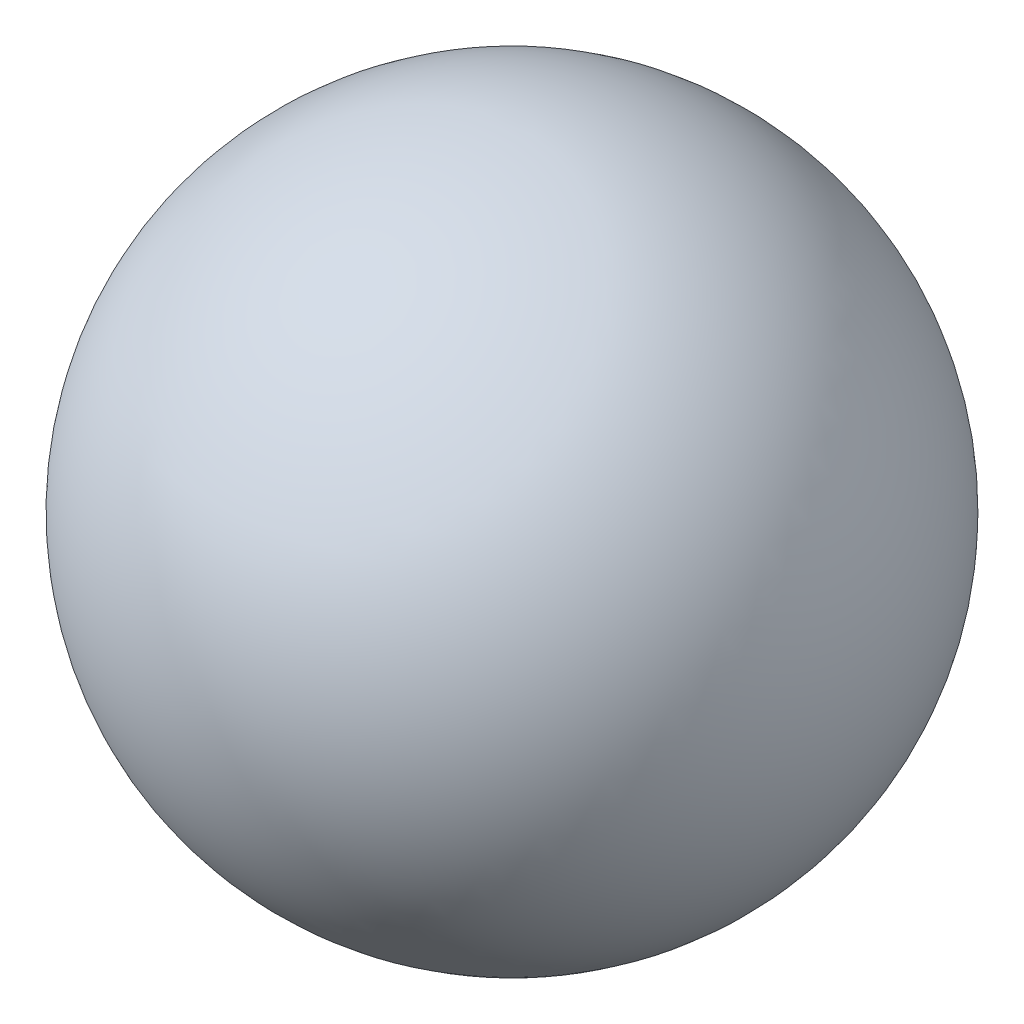
from build123d import *


with BuildPart() as part:
    # Esboço1 → Revolução1 (revolve)
    with BuildSketch(Plane.XY):
        with BuildLine():
            Line((2.280788411, -74.965312006), (-2.280788411, 74.965312006))
            ThreePointArc((-2.280788411, 74.965312006), (-74.965312006, -2.280788411), (2.280788411, -74.965312006))
        make_face()
    revolve(axis=Axis((2.280788411, -74.965312006, 0), (-0.03041051215025888, 0.9995374934192108, 0)))


solid = part.part
